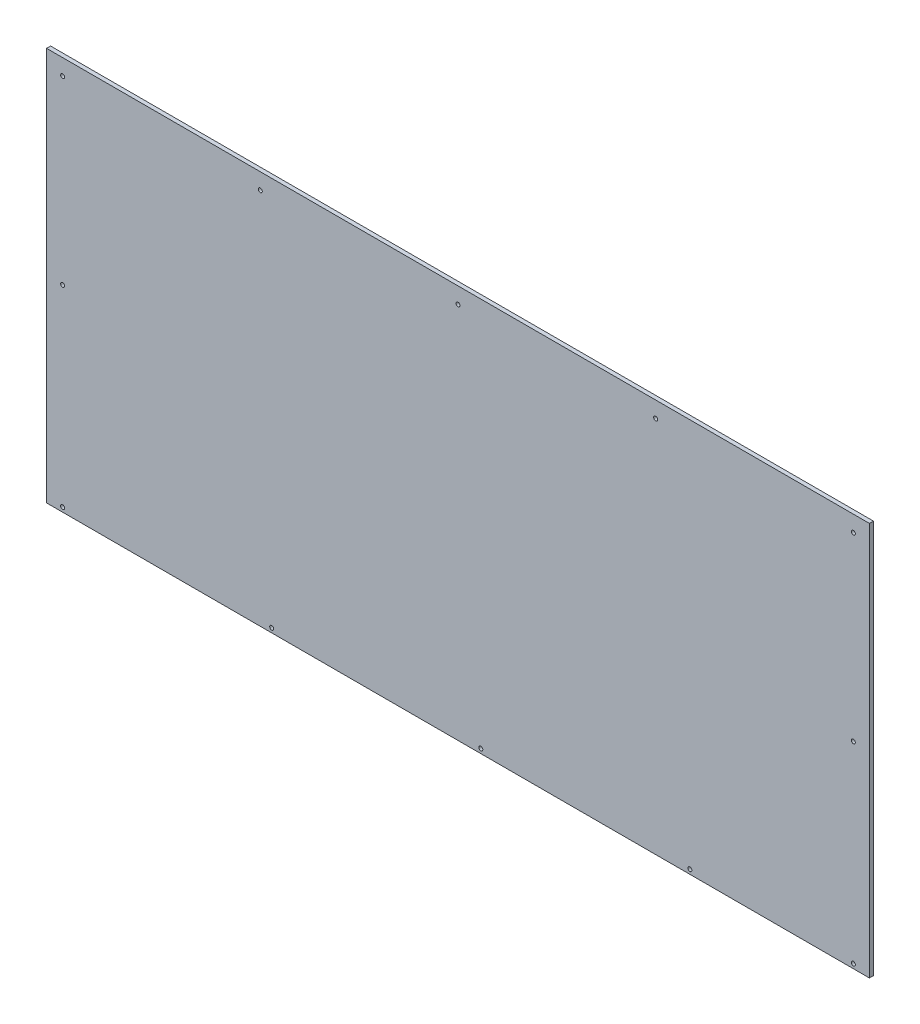
from build123d import *

# Parameters (mm, degrees)
CROQUIS1_W              = 1300
CROQUIS1_H              = 622
SALIENTE_EXTRUIR1_DEPTH = 6.35
CROQUIS2_R              = 3.175
CORTAR_EXTRUIR2_DEPTH   = 6.35


with BuildPart() as part:
    # Croquis1 → Saliente-Extruir1 (new body)
    with BuildSketch(Plane.XY):
        Rectangle(CROQUIS1_W, CROQUIS1_H)
    extrude(amount=SALIENTE_EXTRUIR1_DEPTH)

    # Croquis2 → Cortar-Extruir2 (cut)
    with BuildSketch(Plane.XY.offset(6.35)):
        with Locations((-624.6, 285.6)):
            Circle(CROQUIS2_R)
        with Locations((0, 285.6)):
            Circle(CROQUIS2_R)
        with Locations(Location((624.6, 285.6, 0), (0, 0, 180))):
            Circle(CROQUIS2_R)
        with Locations((-312.3, 285.6)):
            Circle(CROQUIS2_R)
        with Locations((312.3, 285.6)):
            Circle(CROQUIS2_R)
        with Locations((-624.6, 0)):
            Circle(CROQUIS2_R)
        with Locations(Location((624.6, 0, 0), (0, 0, 180))):
            Circle(CROQUIS2_R)
        with Locations((-624.6, -304)):
            Circle(CROQUIS2_R)
        with Locations(Location((624.6, -304, 0), (0, 0, 180))):
            Circle(CROQUIS2_R)
        with Locations((-294.3, -304)):
            Circle(CROQUIS2_R)
        with Locations((36, -304)):
            Circle(CROQUIS2_R)
        with Locations((366.3, -304)):
            Circle(CROQUIS2_R)
    extrude(amount=-CORTAR_EXTRUIR2_DEPTH, mode=Mode.SUBTRACT)


solid = part.part
